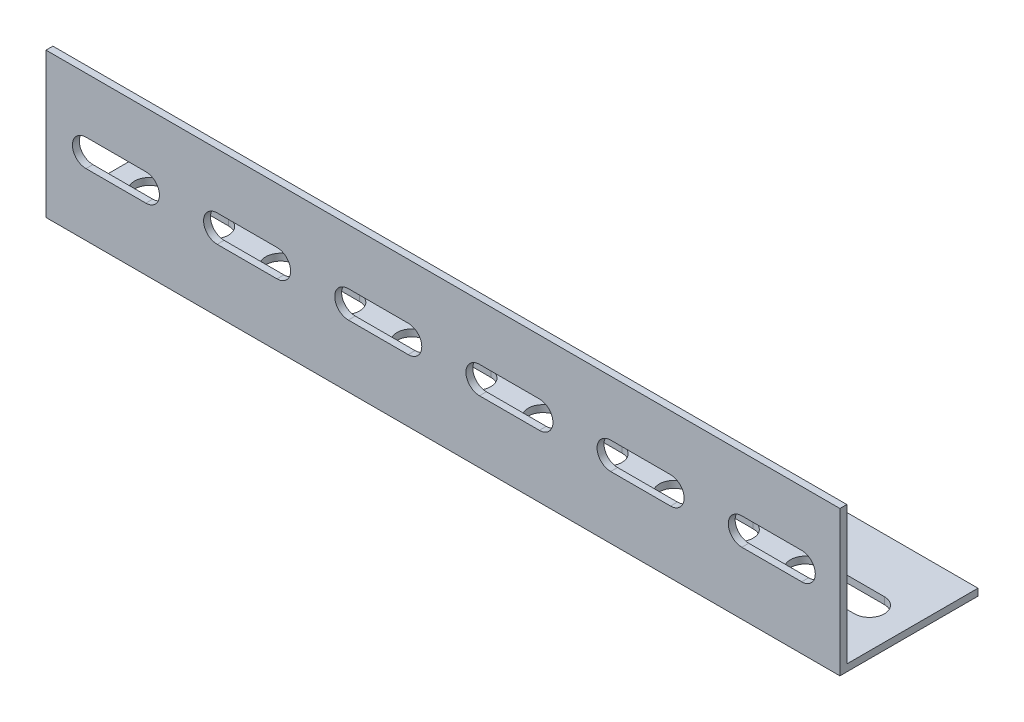
from build123d import *

# Parameters (mm, degrees)
SKETCH1_W           = 150
SKETCH1_H           = 40
BOSS_EXTRUDE1_DEPTH = 2
SKETCH2_W           = 150
SKETCH2_H           = 2
BOSS_EXTRUDE2_DEPTH = 40
BOSS_EXTRUDE3_DEPTH = 80
CUT_EXTRUDE1_DEPTH  = 10
CUT_EXTRUDE2_DEPTH  = 10


with BuildPart() as part:
    # Sketch1 → Boss-Extrude1 (new body)
    with BuildSketch(Plane(origin=(0, 0, 0), x_dir=(1, 0, 0), z_dir=(0, 1, 0))):
        Rectangle(SKETCH1_W, SKETCH1_H)
    extrude(amount=BOSS_EXTRUDE1_DEPTH)

    # Sketch2 → Boss-Extrude2 (add)
    with BuildSketch(Plane(origin=(0, 2, 0), x_dir=(1, 0, 0), z_dir=(0, 1, 0))):
        with Locations((0, -19)):
            Rectangle(SKETCH2_W, SKETCH2_H)
    extrude(amount=BOSS_EXTRUDE2_DEPTH)

    # Sketch5 → Boss-Extrude3 (add)
    with BuildSketch(Plane(origin=(75, 0, 0), x_dir=(0, 0, -1), z_dir=(1, 0, 0))):
        Polygon((-20, 0), (20, 0), (20, 2), (-18, 2), (-18, 42), (-20, 42), align=None)
    extrude(amount=BOSS_EXTRUDE3_DEPTH)

    # Sketch6 → Cut-Extrude1 (cut)
    with BuildSketch(Plane(origin=(0, 0, 18), x_dir=(-1, 0, 0), z_dir=(0, 0, -1))):
        with BuildLine():
            Line((-105.923719426, 25.947585899), (-88.587761645, 25.947585899))
            ThreePointArc((-88.587761645, 25.947585899), (-84.649216654, 22.009040908), (-88.587761645, 18.070495916))
            Line((-88.587761645, 18.070495916), (-105.923719426, 18.070495916))
            ThreePointArc((-105.923719426, 18.070495916), (-109.862264418, 22.009040908), (-105.923719426, 25.947585899))
        make_face()
        with BuildLine():
            Line((-143.923719426, 25.947585899), (-126.587761645, 25.947585899))
            ThreePointArc((-126.587761645, 25.947585899), (-122.649216654, 22.009040908), (-126.587761645, 18.070495916))
            Line((-126.587761645, 18.070495916), (-143.923719426, 18.070495916))
            ThreePointArc((-143.923719426, 18.070495916), (-147.862264418, 22.009040908), (-143.923719426, 25.947585899))
        make_face()
        with BuildLine():
            Line((-67.923719426, 25.947585899), (-50.587761645, 25.947585899))
            ThreePointArc((-50.587761645, 25.947585899), (-46.649216654, 22.009040908), (-50.587761645, 18.070495916))
            Line((-50.587761645, 18.070495916), (-67.923719426, 18.070495916))
            ThreePointArc((-67.923719426, 18.070495916), (-71.862264418, 22.009040908), (-67.923719426, 25.947585899))
        make_face()
        with BuildLine():
            Line((-29.923719426, 25.947585899), (-12.587761645, 25.947585899))
            ThreePointArc((-12.587761645, 25.947585899), (-8.649216654, 22.009040908), (-12.587761645, 18.070495916))
            Line((-12.587761645, 18.070495916), (-29.923719426, 18.070495916))
            ThreePointArc((-29.923719426, 18.070495916), (-33.862264418, 22.009040908), (-29.923719426, 25.947585899))
        make_face()
        with BuildLine():
            Line((8.076280574, 25.947585899), (25.412238355, 25.947585899))
            ThreePointArc((25.412238355, 25.947585899), (29.350783346, 22.009040908), (25.412238355, 18.070495916))
            Line((25.412238355, 18.070495916), (8.076280574, 18.070495916))
            ThreePointArc((8.076280574, 18.070495916), (4.137735582, 22.009040908), (8.076280574, 25.947585899))
        make_face()
        with BuildLine():
            Line((46.076280574, 25.947585899), (63.412238355, 25.947585899))
            ThreePointArc((63.412238355, 25.947585899), (67.350783346, 22.009040908), (63.412238355, 18.070495916))
            Line((63.412238355, 18.070495916), (46.076280574, 18.070495916))
            ThreePointArc((46.076280574, 18.070495916), (42.137735582, 22.009040908), (46.076280574, 25.947585899))
        make_face()
    extrude(amount=-CUT_EXTRUDE1_DEPTH, mode=Mode.SUBTRACT)

    # Sketch7 → Cut-Extrude2 (cut)
    with BuildSketch(Plane.XZ):
        with BuildLine():
            Line((-27.006843458, 4.316067859), (-8.446451171, 4.316067859))
            ThreePointArc((-8.446451171, 4.316067859), (-4.130383312, 0), (-8.446451171, -4.316067859))
            Line((-8.446451171, -4.316067859), (-27.006843458, -4.316067859))
            ThreePointArc((-27.006843458, -4.316067859), (-31.322911318, 0), (-27.006843458, 4.316067859))
        make_face()
        with BuildLine():
            Line((-65.006843458, 4.316067859), (-46.446451171, 4.316067859))
            ThreePointArc((-46.446451171, 4.316067859), (-42.130383312, 0), (-46.446451171, -4.316067859))
            Line((-46.446451171, -4.316067859), (-65.006843458, -4.316067859))
            ThreePointArc((-65.006843458, -4.316067859), (-69.322911318, 0), (-65.006843458, 4.316067859))
        make_face()
        with BuildLine():
            Line((10.993156542, 4.316067859), (29.553548829, 4.316067859))
            ThreePointArc((29.553548829, 4.316067859), (33.869616688, 0), (29.553548829, -4.316067859))
            Line((29.553548829, -4.316067859), (10.993156542, -4.316067859))
            ThreePointArc((10.993156542, -4.316067859), (6.677088682, 0), (10.993156542, 4.316067859))
        make_face()
        with BuildLine():
            Line((48.993156542, 4.316067859), (67.553548829, 4.316067859))
            ThreePointArc((67.553548829, 4.316067859), (71.869616688, 0), (67.553548829, -4.316067859))
            Line((67.553548829, -4.316067859), (48.993156542, -4.316067859))
            ThreePointArc((48.993156542, -4.316067859), (44.677088682, 0), (48.993156542, 4.316067859))
        make_face()
        with BuildLine():
            Line((86.993156542, 4.316067859), (105.553548829, 4.316067859))
            ThreePointArc((105.553548829, 4.316067859), (109.869616688, 0), (105.553548829, -4.316067859))
            Line((105.553548829, -4.316067859), (86.993156542, -4.316067859))
            ThreePointArc((86.993156542, -4.316067859), (82.677088682, 0), (86.993156542, 4.316067859))
        make_face()
        with BuildLine():
            Line((124.993156542, 4.316067859), (143.553548829, 4.316067859))
            ThreePointArc((143.553548829, 4.316067859), (147.869616688, 0), (143.553548829, -4.316067859))
            Line((143.553548829, -4.316067859), (124.993156542, -4.316067859))
            ThreePointArc((124.993156542, -4.316067859), (120.677088682, 0), (124.993156542, 4.316067859))
        make_face()
    extrude(amount=-CUT_EXTRUDE2_DEPTH, mode=Mode.SUBTRACT)


solid = part.part
